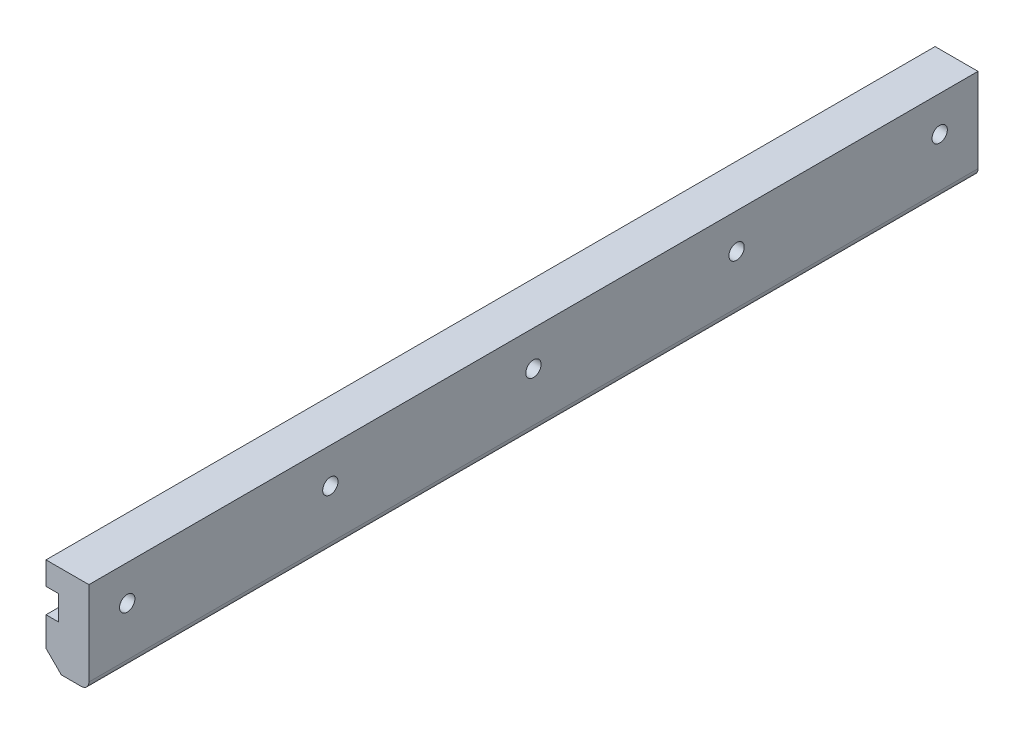
from build123d import *

# Parameters (mm, degrees)
BOSS_EXTRUDE1_DEPTH = 290
SKETCH2_R           = 5
CUT_EXTRUDE1_DEPTH  = 298.462602691


with BuildPart() as part:
    # Sketch1 → Boss-Extrude1 (new, symmetric)
    with BuildSketch(Plane.XY):
        with BuildLine():
            Line((0, 60), (0, 5))
            ThreePointArc((0, 5), (-1.464466094, 1.464466094), (-5, 0))
            Line((-5, 0), (-18, 0))
            Line((-18, 0), (-28, 10))
            Line((-28, 10), (-28, 29))
            Line((-28, 29), (-20, 29))
            Line((-20, 29), (-20, 45))
            Line((-20, 45), (-28, 45))
            Line((-28, 45), (-28, 60))
            Line((-28, 60), (0, 60))
        make_face()
    extrude(amount=BOSS_EXTRUDE1_DEPTH, both=True)

    # Sketch2 → Cut-Extrude1 (cut, through all)
    with BuildSketch(Plane(origin=(0, 0, 0), x_dir=(0, 0, -1), z_dir=(1, 0, 0))):
        with Locations((-265, 37)):
            Circle(SKETCH2_R)
        with Locations((-132.5, 37)):
            Circle(SKETCH2_R)
        with Locations((0, 37)):
            Circle(SKETCH2_R)
        with Locations((132.5, 37)):
            Circle(SKETCH2_R)
        with Locations((265, 37)):
            Circle(SKETCH2_R)
    extrude(amount=-CUT_EXTRUDE1_DEPTH, mode=Mode.SUBTRACT)


solid = part.part
